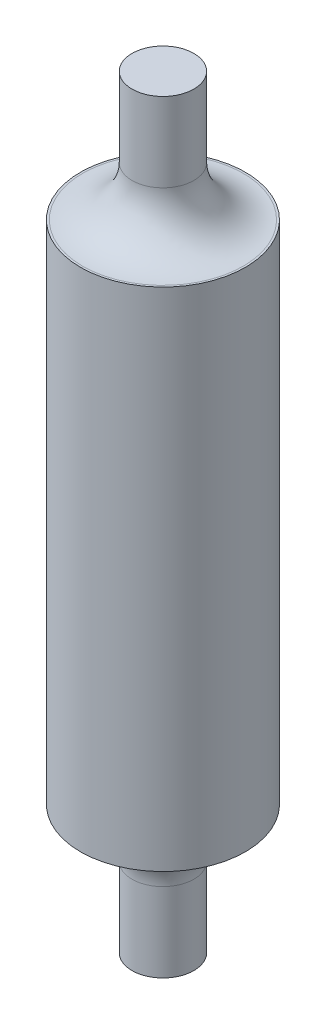
from build123d import *

# Parameters (mm, degrees)
SKETCH1_R           = 12.7
BOSS_EXTRUDE1_DEPTH = 77.978
SKETCH2_R           = 4.7625
BOSS_EXTRUDE2_DEPTH = 19.812
FILLET1_R           = 7.62


with BuildPart() as part:
    # Sketch1 → Boss-Extrude1 (new body)
    with BuildSketch(Plane(origin=(0, 0, 0), x_dir=(1, 0, 0), z_dir=(0, 1, 0))):
        with Locations(Location((0, 0, 0), (0, 0, 270))):
            Circle(SKETCH1_R)
    extrude(amount=BOSS_EXTRUDE1_DEPTH)

    # Sketch2 → Boss-Extrude2 (add)
    with BuildSketch(Plane(origin=(0, 77.978, 0), x_dir=(1, 0, 0), z_dir=(0, 1, 0))):
        with Locations(Location((0, 0, 0), (0, 0, 270))):
            Circle(SKETCH2_R)
    boss_extrude2 = extrude(amount=BOSS_EXTRUDE2_DEPTH)

    # Mirror1: Boss-Extrude2 across plane
    add(boss_extrude2.mirror(Plane.ZX.offset(38.989)))

    # Fillet1
    fillet1_edges = [part.edges().sort_by_distance(p)[0] for p in [
        (0, 0, -4.7625),
        (0, 77.978, -4.7625),
    ]]
    fillet(fillet1_edges, radius=FILLET1_R)


solid = part.part
